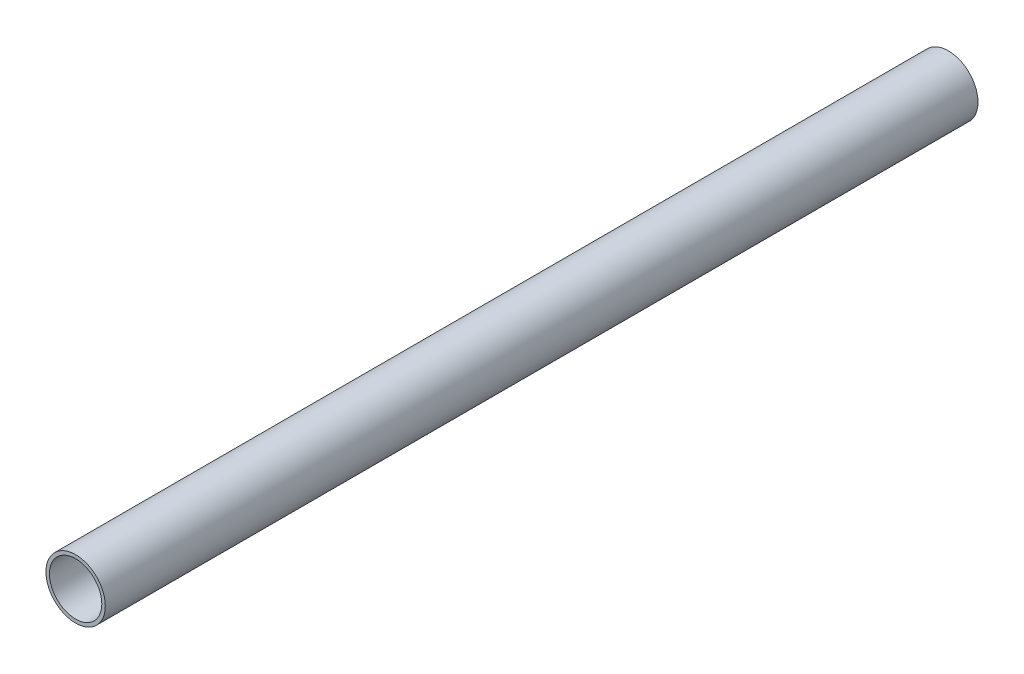
from build123d import *

# Parameters (mm, degrees)
SKETCH1_R           = 17
SKETCH1_R_2         = 15
BOSS_EXTRUDE1_DEPTH = 500


with BuildPart() as part:
    # Sketch1 → Boss-Extrude1 (new body)
    with BuildSketch(Plane.XY):
        Circle(SKETCH1_R)
        Circle(SKETCH1_R_2, mode=Mode.SUBTRACT)
    extrude(amount=BOSS_EXTRUDE1_DEPTH)


solid = part.part
